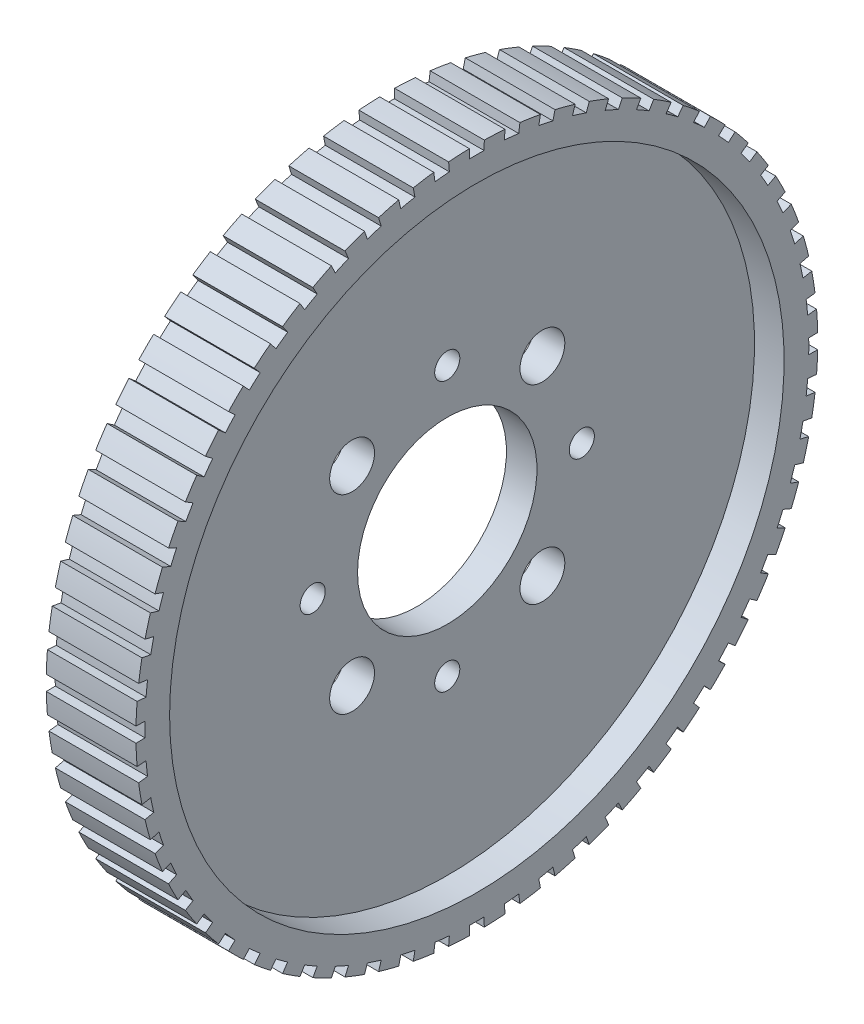
from build123d import *

# Parameters (mm, degrees)
SKETCH2_R          = 1.778
SKETCH2_R_2        = 3.175
CUT_EXTRUDE1_DEPTH = 69.778327117
CUT_EXTRUDE2_DEPTH = 70.421503873


with BuildPart() as part:
    # Sketch1 → Revolve1 (revolve)
    with BuildSketch(Plane.XY, mode=Mode.PRIVATE) as revolve1_sk:
        Polygon((-2.159, 12.7), (2.159, 12.7), (2.159, 43.4975), (6.35, 43.4975), (6.35, 48.26), (-6.35, 48.26), (-6.35, 43.4975), (-2.159, 43.4975), align=None)
    revolve(revolve1_sk.sketch.rotate(Axis((0, 0, 0), (1, 0, 0)), 90), axis=Axis((0, 0, 0), (1, 0, 0)))

    # Sketch2 → Cut-Extrude1 (cut, through all)
    with BuildSketch(Plane(origin=(2.159, 0, 0), x_dir=(0, 0, -1), z_dir=(1, 0, 0))):
        with Locations((0, 19.05)):
            Circle(SKETCH2_R)
        with Locations((19.05, 0)):
            Circle(SKETCH2_R)
        with Locations((0, -19.05)):
            Circle(SKETCH2_R)
        with Locations((-19.05, 0)):
            Circle(SKETCH2_R)
        with Locations((-13.470384182, 13.470384182)):
            Circle(SKETCH2_R_2)
        with Locations((13.470384182, 13.470384182)):
            Circle(SKETCH2_R_2)
        with Locations((13.470384182, -13.470384182)):
            Circle(SKETCH2_R_2)
        with Locations((-13.470384182, -13.470384182)):
            Circle(SKETCH2_R_2)
    extrude(amount=-CUT_EXTRUDE1_DEPTH, mode=Mode.SUBTRACT)

    # Sketch3 → Cut-Extrude2 (cut, through all)
    with BuildSketch(Plane(origin=(6.35, 0, 0), x_dir=(0, 0, -1), z_dir=(1, 0, 0))):
        with BuildLine():
            Line((-1.025081448, 46.978817652), (-1.080504445, 49.518817652))
            Line((-1.080504445, 49.518817652), (1.080504445, 49.518817652))
            Line((1.080504445, 49.518817652), (1.025081448, 46.978817652))
            ThreePointArc((1.025081448, 46.978817652), (0, 46.99), (-1.025081448, 46.978817652))
        make_face()
        with BuildLine():
            Line((4.101540584, 49.360491857), (6.250711241, 49.134604919))
            Line((6.250711241, 49.134604919), (5.93008956, 46.614312585))
            ThreePointArc((5.93008956, 46.614312585), (4.911792489, 46.732583863), (3.891157671, 46.828612962))
            Line((3.891157671, 46.828612962), (4.101540584, 49.360491857))
        make_face()
        with BuildLine():
            Line((9.238648275, 48.661362184), (11.352433936, 48.212063172))
            Line((11.352433936, 48.212063172), (10.770126369, 45.739091355))
            ThreePointArc((10.770126369, 45.739091355), (9.769770352, 45.963155758), (8.764764452, 46.165344189))
            Line((8.764764452, 46.165344189), (9.238648275, 48.661362184))
        make_face()
        with BuildLine():
            Line((14.274535403, 47.429088444), (16.329776989, 46.761299972))
            Line((16.329776989, 46.761299972), (15.492163421, 44.362743068))
            ThreePointArc((15.492163421, 44.362743068), (14.520708566, 44.690145701), (13.54234264, 44.996278244))
            Line((13.54234264, 44.996278244), (14.274535403, 47.429088444))
        make_face()
        with BuildLine():
            Line((19.154027733, 45.677171685), (21.128207589, 44.798210183))
            Line((21.128207589, 44.798210183), (20.044465088, 42.500347285))
            ThreePointArc((20.044465088, 42.500347285), (19.112554858, 42.927501055), (18.171548087, 43.334223659))
            Line((18.171548087, 43.334223659), (19.154027733, 45.677171685))
        make_face()
        with BuildLine():
            Line((23.823664528, 43.424806275), (25.695153124, 42.34430183))
            Line((25.695153124, 42.34430183), (24.377155401, 40.172308803))
            ThreePointArc((24.377155401, 40.172308803), (23.495, 40.694533724), (22.601662252, 41.197390251))
            Line((22.601662252, 41.197390251), (23.823664528, 43.424806275))
        make_face()
        with BuildLine():
            Line((28.232284269, 40.6966696), (29.980577186, 39.426460444))
            Line((29.980577186, 39.426460444), (28.442764498, 37.404134099))
            ThreePointArc((28.442764498, 37.404134099), (27.620029005, 38.015708566), (26.784147874, 38.609189614))
            Line((26.784147874, 38.609189614), (28.232284269, 40.6966696))
        make_face()
        with BuildLine():
            Line((32.331585195, 37.522651697), (33.937527769, 36.076654508))
            Line((33.937527769, 36.076654508), (32.196748715, 34.226151875))
            ThreePointArc((32.196748715, 34.226151875), (31.442447193, 34.920375349), (30.673180768, 35.597978616))
            Line((30.673180768, 35.597978616), (32.331585195, 37.522651697))
        make_face()
        with BuildLine():
            Line((36.076654508, 33.937527769), (37.522651697, 32.331585195))
            Line((37.522651697, 32.331585195), (35.597978616, 30.673180768))
            ThreePointArc((35.597978616, 30.673180768), (34.920375349, 31.442447193), (34.226151875, 32.196748715))
            Line((34.226151875, 32.196748715), (36.076654508, 33.937527769))
        make_face()
        with BuildLine():
            Line((39.426460444, 29.980577186), (40.6966696, 28.232284269))
            Line((40.6966696, 28.232284269), (38.609189614, 26.784147874))
            ThreePointArc((38.609189614, 26.784147874), (38.015708566, 27.620029005), (37.404134099, 28.442764498))
            Line((37.404134099, 28.442764498), (39.426460444, 29.980577186))
        make_face()
        with BuildLine():
            Line((42.34430183, 25.695153124), (43.424806275, 23.823664528))
            Line((43.424806275, 23.823664528), (41.197390251, 22.601662252))
            ThreePointArc((41.197390251, 22.601662252), (40.694533724, 23.495), (40.172308803, 24.377155401))
            Line((40.172308803, 24.377155401), (42.34430183, 25.695153124))
        make_face()
        with BuildLine():
            Line((44.798210183, 21.128207589), (45.677171685, 19.154027733))
            Line((45.677171685, 19.154027733), (43.334223659, 18.171548087))
            ThreePointArc((43.334223659, 18.171548087), (42.927501055, 19.112554858), (42.500347285, 20.044465088))
            Line((42.500347285, 20.044465088), (44.798210183, 21.128207589))
        make_face()
        with BuildLine():
            Line((46.761299972, 16.329776989), (47.429088444, 14.274535403))
            Line((47.429088444, 14.274535403), (44.996278244, 13.54234264))
            ThreePointArc((44.996278244, 13.54234264), (44.690145701, 14.520708566), (44.362743068, 15.492163421))
            Line((44.362743068, 15.492163421), (46.761299972, 16.329776989))
        make_face()
        with BuildLine():
            Line((48.212063172, 11.352433936), (48.661362184, 9.238648275))
            Line((48.661362184, 9.238648275), (46.165344189, 8.764764452))
            ThreePointArc((46.165344189, 8.764764452), (45.963155758, 9.769770352), (45.739091355, 10.770126369))
            Line((45.739091355, 10.770126369), (48.212063172, 11.352433936))
        make_face()
        with BuildLine():
            Line((49.134604919, 6.250711241), (49.360491857, 4.101540584))
            Line((49.360491857, 4.101540584), (46.828612962, 3.891157671))
            ThreePointArc((46.828612962, 3.891157671), (46.732583863, 4.911792489), (46.614312585, 5.93008956))
            Line((46.614312585, 5.93008956), (49.134604919, 6.250711241))
        make_face()
        with BuildLine():
            Line((49.518817652, 1.080504445), (49.518817652, -1.080504445))
            Line((49.518817652, -1.080504445), (46.978817652, -1.025081448))
            ThreePointArc((46.978817652, -1.025081448), (46.99, 0), (46.978817652, 1.025081448))
            Line((46.978817652, 1.025081448), (49.518817652, 1.080504445))
        make_face()
        with BuildLine():
            Line((49.360491857, -4.101540584), (49.134604919, -6.250711241))
            Line((49.134604919, -6.250711241), (46.614312585, -5.93008956))
            ThreePointArc((46.614312585, -5.93008956), (46.732583863, -4.911792489), (46.828612962, -3.891157671))
            Line((46.828612962, -3.891157671), (49.360491857, -4.101540584))
        make_face()
        with BuildLine():
            Line((48.661362184, -9.238648275), (48.212063172, -11.352433936))
            Line((48.212063172, -11.352433936), (45.739091355, -10.770126369))
            ThreePointArc((45.739091355, -10.770126369), (45.963155758, -9.769770352), (46.165344189, -8.764764452))
            Line((46.165344189, -8.764764452), (48.661362184, -9.238648275))
        make_face()
        with BuildLine():
            Line((47.429088444, -14.274535403), (46.761299972, -16.329776989))
            Line((46.761299972, -16.329776989), (44.362743068, -15.492163421))
            ThreePointArc((44.362743068, -15.492163421), (44.690145701, -14.520708566), (44.996278244, -13.54234264))
            Line((44.996278244, -13.54234264), (47.429088444, -14.274535403))
        make_face()
        with BuildLine():
            Line((45.677171685, -19.154027733), (44.798210183, -21.128207589))
            Line((44.798210183, -21.128207589), (42.500347285, -20.044465088))
            ThreePointArc((42.500347285, -20.044465088), (42.927501055, -19.112554858), (43.334223659, -18.171548087))
            Line((43.334223659, -18.171548087), (45.677171685, -19.154027733))
        make_face()
        with BuildLine():
            Line((43.424806275, -23.823664528), (42.34430183, -25.695153124))
            Line((42.34430183, -25.695153124), (40.172308803, -24.377155401))
            ThreePointArc((40.172308803, -24.377155401), (40.694533724, -23.495), (41.197390251, -22.601662252))
            Line((41.197390251, -22.601662252), (43.424806275, -23.823664528))
        make_face()
        with BuildLine():
            Line((40.6966696, -28.232284269), (39.426460444, -29.980577186))
            Line((39.426460444, -29.980577186), (37.404134099, -28.442764498))
            ThreePointArc((37.404134099, -28.442764498), (38.015708566, -27.620029005), (38.609189614, -26.784147874))
            Line((38.609189614, -26.784147874), (40.6966696, -28.232284269))
        make_face()
        with BuildLine():
            Line((37.522651697, -32.331585195), (36.076654508, -33.937527769))
            Line((36.076654508, -33.937527769), (34.226151875, -32.196748715))
            ThreePointArc((34.226151875, -32.196748715), (34.920375349, -31.442447193), (35.597978616, -30.673180768))
            Line((35.597978616, -30.673180768), (37.522651697, -32.331585195))
        make_face()
        with BuildLine():
            Line((33.937527769, -36.076654508), (32.331585195, -37.522651697))
            Line((32.331585195, -37.522651697), (30.673180768, -35.597978616))
            ThreePointArc((30.673180768, -35.597978616), (31.442447193, -34.920375349), (32.196748715, -34.226151875))
            Line((32.196748715, -34.226151875), (33.937527769, -36.076654508))
        make_face()
        with BuildLine():
            Line((29.980577186, -39.426460444), (28.232284269, -40.6966696))
            Line((28.232284269, -40.6966696), (26.784147874, -38.609189614))
            ThreePointArc((26.784147874, -38.609189614), (27.620029005, -38.015708566), (28.442764498, -37.404134099))
            Line((28.442764498, -37.404134099), (29.980577186, -39.426460444))
        make_face()
        with BuildLine():
            Line((25.695153124, -42.34430183), (23.823664528, -43.424806275))
            Line((23.823664528, -43.424806275), (22.601662252, -41.197390251))
            ThreePointArc((22.601662252, -41.197390251), (23.495, -40.694533724), (24.377155401, -40.172308803))
            Line((24.377155401, -40.172308803), (25.695153124, -42.34430183))
        make_face()
        with BuildLine():
            Line((21.128207589, -44.798210183), (19.154027733, -45.677171685))
            Line((19.154027733, -45.677171685), (18.171548087, -43.334223659))
            ThreePointArc((18.171548087, -43.334223659), (19.112554858, -42.927501055), (20.044465088, -42.500347285))
            Line((20.044465088, -42.500347285), (21.128207589, -44.798210183))
        make_face()
        with BuildLine():
            Line((16.329776989, -46.761299972), (14.274535403, -47.429088444))
            Line((14.274535403, -47.429088444), (13.54234264, -44.996278244))
            ThreePointArc((13.54234264, -44.996278244), (14.520708566, -44.690145701), (15.492163421, -44.362743068))
            Line((15.492163421, -44.362743068), (16.329776989, -46.761299972))
        make_face()
        with BuildLine():
            Line((11.352433936, -48.212063172), (9.238648275, -48.661362184))
            Line((9.238648275, -48.661362184), (8.764764452, -46.165344189))
            ThreePointArc((8.764764452, -46.165344189), (9.769770352, -45.963155758), (10.770126369, -45.739091355))
            Line((10.770126369, -45.739091355), (11.352433936, -48.212063172))
        make_face()
        with BuildLine():
            Line((6.250711241, -49.134604919), (4.101540584, -49.360491857))
            Line((4.101540584, -49.360491857), (3.891157671, -46.828612962))
            ThreePointArc((3.891157671, -46.828612962), (4.911792489, -46.732583863), (5.93008956, -46.614312585))
            Line((5.93008956, -46.614312585), (6.250711241, -49.134604919))
        make_face()
        with BuildLine():
            Line((1.080504445, -49.518817652), (-1.080504445, -49.518817652))
            Line((-1.080504445, -49.518817652), (-1.025081448, -46.978817652))
            ThreePointArc((-1.025081448, -46.978817652), (0, -46.99), (1.025081448, -46.978817652))
            Line((1.025081448, -46.978817652), (1.080504445, -49.518817652))
        make_face()
        with BuildLine():
            Line((-4.101540584, -49.360491857), (-6.250711241, -49.134604919))
            Line((-6.250711241, -49.134604919), (-5.93008956, -46.614312585))
            ThreePointArc((-5.93008956, -46.614312585), (-4.911792489, -46.732583863), (-3.891157671, -46.828612962))
            Line((-3.891157671, -46.828612962), (-4.101540584, -49.360491857))
        make_face()
        with BuildLine():
            Line((-9.238648275, -48.661362184), (-11.352433936, -48.212063172))
            Line((-11.352433936, -48.212063172), (-10.770126369, -45.739091355))
            ThreePointArc((-10.770126369, -45.739091355), (-9.769770352, -45.963155758), (-8.764764452, -46.165344189))
            Line((-8.764764452, -46.165344189), (-9.238648275, -48.661362184))
        make_face()
        with BuildLine():
            Line((-14.274535403, -47.429088444), (-16.329776989, -46.761299972))
            Line((-16.329776989, -46.761299972), (-15.492163421, -44.362743068))
            ThreePointArc((-15.492163421, -44.362743068), (-14.520708566, -44.690145701), (-13.54234264, -44.996278244))
            Line((-13.54234264, -44.996278244), (-14.274535403, -47.429088444))
        make_face()
        with BuildLine():
            Line((-19.154027733, -45.677171685), (-21.128207589, -44.798210183))
            Line((-21.128207589, -44.798210183), (-20.044465088, -42.500347285))
            ThreePointArc((-20.044465088, -42.500347285), (-19.112554858, -42.927501055), (-18.171548087, -43.334223659))
            Line((-18.171548087, -43.334223659), (-19.154027733, -45.677171685))
        make_face()
        with BuildLine():
            Line((-23.823664528, -43.424806275), (-25.695153124, -42.34430183))
            Line((-25.695153124, -42.34430183), (-24.377155401, -40.172308803))
            ThreePointArc((-24.377155401, -40.172308803), (-23.495, -40.694533724), (-22.601662252, -41.197390251))
            Line((-22.601662252, -41.197390251), (-23.823664528, -43.424806275))
        make_face()
        with BuildLine():
            Line((-28.232284269, -40.6966696), (-29.980577186, -39.426460444))
            Line((-29.980577186, -39.426460444), (-28.442764498, -37.404134099))
            ThreePointArc((-28.442764498, -37.404134099), (-27.620029005, -38.015708566), (-26.784147874, -38.609189614))
            Line((-26.784147874, -38.609189614), (-28.232284269, -40.6966696))
        make_face()
        with BuildLine():
            Line((-32.331585195, -37.522651697), (-33.937527769, -36.076654508))
            Line((-33.937527769, -36.076654508), (-32.196748715, -34.226151875))
            ThreePointArc((-32.196748715, -34.226151875), (-31.442447193, -34.920375349), (-30.673180768, -35.597978616))
            Line((-30.673180768, -35.597978616), (-32.331585195, -37.522651697))
        make_face()
        with BuildLine():
            Line((-36.076654508, -33.937527769), (-37.522651697, -32.331585195))
            Line((-37.522651697, -32.331585195), (-35.597978616, -30.673180768))
            ThreePointArc((-35.597978616, -30.673180768), (-34.920375349, -31.442447193), (-34.226151875, -32.196748715))
            Line((-34.226151875, -32.196748715), (-36.076654508, -33.937527769))
        make_face()
        with BuildLine():
            Line((-39.426460444, -29.980577186), (-40.6966696, -28.232284269))
            Line((-40.6966696, -28.232284269), (-38.609189614, -26.784147874))
            ThreePointArc((-38.609189614, -26.784147874), (-38.015708566, -27.620029005), (-37.404134099, -28.442764498))
            Line((-37.404134099, -28.442764498), (-39.426460444, -29.980577186))
        make_face()
        with BuildLine():
            Line((-42.34430183, -25.695153124), (-43.424806275, -23.823664528))
            Line((-43.424806275, -23.823664528), (-41.197390251, -22.601662252))
            ThreePointArc((-41.197390251, -22.601662252), (-40.694533724, -23.495), (-40.172308803, -24.377155401))
            Line((-40.172308803, -24.377155401), (-42.34430183, -25.695153124))
        make_face()
        with BuildLine():
            Line((-44.798210183, -21.128207589), (-45.677171685, -19.154027733))
            Line((-45.677171685, -19.154027733), (-43.334223659, -18.171548087))
            ThreePointArc((-43.334223659, -18.171548087), (-42.927501055, -19.112554858), (-42.500347285, -20.044465088))
            Line((-42.500347285, -20.044465088), (-44.798210183, -21.128207589))
        make_face()
        with BuildLine():
            Line((-46.761299972, -16.329776989), (-47.429088444, -14.274535403))
            Line((-47.429088444, -14.274535403), (-44.996278244, -13.54234264))
            ThreePointArc((-44.996278244, -13.54234264), (-44.690145701, -14.520708566), (-44.362743068, -15.492163421))
            Line((-44.362743068, -15.492163421), (-46.761299972, -16.329776989))
        make_face()
        with BuildLine():
            Line((-48.212063172, -11.352433936), (-48.661362184, -9.238648275))
            Line((-48.661362184, -9.238648275), (-46.165344189, -8.764764452))
            ThreePointArc((-46.165344189, -8.764764452), (-45.963155758, -9.769770352), (-45.739091355, -10.770126369))
            Line((-45.739091355, -10.770126369), (-48.212063172, -11.352433936))
        make_face()
        with BuildLine():
            Line((-49.134604919, -6.250711241), (-49.360491857, -4.101540584))
            Line((-49.360491857, -4.101540584), (-46.828612962, -3.891157671))
            ThreePointArc((-46.828612962, -3.891157671), (-46.732583863, -4.911792489), (-46.614312585, -5.93008956))
            Line((-46.614312585, -5.93008956), (-49.134604919, -6.250711241))
        make_face()
        with BuildLine():
            Line((-49.518817652, -1.080504445), (-49.518817652, 1.080504445))
            Line((-49.518817652, 1.080504445), (-46.978817652, 1.025081448))
            ThreePointArc((-46.978817652, 1.025081448), (-46.99, 0), (-46.978817652, -1.025081448))
            Line((-46.978817652, -1.025081448), (-49.518817652, -1.080504445))
        make_face()
        with BuildLine():
            Line((-49.360491857, 4.101540584), (-49.134604919, 6.250711241))
            Line((-49.134604919, 6.250711241), (-46.614312585, 5.93008956))
            ThreePointArc((-46.614312585, 5.93008956), (-46.732583863, 4.911792489), (-46.828612962, 3.891157671))
            Line((-46.828612962, 3.891157671), (-49.360491857, 4.101540584))
        make_face()
        with BuildLine():
            Line((-48.661362184, 9.238648275), (-48.212063172, 11.352433936))
            Line((-48.212063172, 11.352433936), (-45.739091355, 10.770126369))
            ThreePointArc((-45.739091355, 10.770126369), (-45.963155758, 9.769770352), (-46.165344189, 8.764764452))
            Line((-46.165344189, 8.764764452), (-48.661362184, 9.238648275))
        make_face()
        with BuildLine():
            Line((-47.429088444, 14.274535403), (-46.761299972, 16.329776989))
            Line((-46.761299972, 16.329776989), (-44.362743068, 15.492163421))
            ThreePointArc((-44.362743068, 15.492163421), (-44.690145701, 14.520708566), (-44.996278244, 13.54234264))
            Line((-44.996278244, 13.54234264), (-47.429088444, 14.274535403))
        make_face()
        with BuildLine():
            Line((-45.677171685, 19.154027733), (-44.798210183, 21.128207589))
            Line((-44.798210183, 21.128207589), (-42.500347285, 20.044465088))
            ThreePointArc((-42.500347285, 20.044465088), (-42.927501055, 19.112554858), (-43.334223659, 18.171548087))
            Line((-43.334223659, 18.171548087), (-45.677171685, 19.154027733))
        make_face()
        with BuildLine():
            Line((-43.424806275, 23.823664528), (-42.34430183, 25.695153124))
            Line((-42.34430183, 25.695153124), (-40.172308803, 24.377155401))
            ThreePointArc((-40.172308803, 24.377155401), (-40.694533724, 23.495), (-41.197390251, 22.601662252))
            Line((-41.197390251, 22.601662252), (-43.424806275, 23.823664528))
        make_face()
        with BuildLine():
            Line((-40.6966696, 28.232284269), (-39.426460444, 29.980577186))
            Line((-39.426460444, 29.980577186), (-37.404134099, 28.442764498))
            ThreePointArc((-37.404134099, 28.442764498), (-38.015708566, 27.620029005), (-38.609189614, 26.784147874))
            Line((-38.609189614, 26.784147874), (-40.6966696, 28.232284269))
        make_face()
        with BuildLine():
            Line((-37.522651697, 32.331585195), (-36.076654508, 33.937527769))
            Line((-36.076654508, 33.937527769), (-34.226151875, 32.196748715))
            ThreePointArc((-34.226151875, 32.196748715), (-34.920375349, 31.442447193), (-35.597978616, 30.673180768))
            Line((-35.597978616, 30.673180768), (-37.522651697, 32.331585195))
        make_face()
        with BuildLine():
            Line((-33.937527769, 36.076654508), (-32.331585195, 37.522651697))
            Line((-32.331585195, 37.522651697), (-30.673180768, 35.597978616))
            ThreePointArc((-30.673180768, 35.597978616), (-31.442447193, 34.920375349), (-32.196748715, 34.226151875))
            Line((-32.196748715, 34.226151875), (-33.937527769, 36.076654508))
        make_face()
        with BuildLine():
            Line((-29.980577186, 39.426460444), (-28.232284269, 40.6966696))
            Line((-28.232284269, 40.6966696), (-26.784147874, 38.609189614))
            ThreePointArc((-26.784147874, 38.609189614), (-27.620029005, 38.015708566), (-28.442764498, 37.404134099))
            Line((-28.442764498, 37.404134099), (-29.980577186, 39.426460444))
        make_face()
        with BuildLine():
            Line((-25.695153124, 42.34430183), (-23.823664528, 43.424806275))
            Line((-23.823664528, 43.424806275), (-22.601662252, 41.197390251))
            ThreePointArc((-22.601662252, 41.197390251), (-23.495, 40.694533724), (-24.377155401, 40.172308803))
            Line((-24.377155401, 40.172308803), (-25.695153124, 42.34430183))
        make_face()
        with BuildLine():
            Line((-21.128207589, 44.798210183), (-19.154027733, 45.677171685))
            Line((-19.154027733, 45.677171685), (-18.171548087, 43.334223659))
            ThreePointArc((-18.171548087, 43.334223659), (-19.112554858, 42.927501055), (-20.044465088, 42.500347285))
            Line((-20.044465088, 42.500347285), (-21.128207589, 44.798210183))
        make_face()
        with BuildLine():
            Line((-16.329776989, 46.761299972), (-14.274535403, 47.429088444))
            Line((-14.274535403, 47.429088444), (-13.54234264, 44.996278244))
            ThreePointArc((-13.54234264, 44.996278244), (-14.520708566, 44.690145701), (-15.492163421, 44.362743068))
            Line((-15.492163421, 44.362743068), (-16.329776989, 46.761299972))
        make_face()
        with BuildLine():
            Line((-11.352433936, 48.212063172), (-9.238648275, 48.661362184))
            Line((-9.238648275, 48.661362184), (-8.764764452, 46.165344189))
            ThreePointArc((-8.764764452, 46.165344189), (-9.769770352, 45.963155758), (-10.770126369, 45.739091355))
            Line((-10.770126369, 45.739091355), (-11.352433936, 48.212063172))
        make_face()
        with BuildLine():
            Line((-6.250711241, 49.134604919), (-4.101540584, 49.360491857))
            Line((-4.101540584, 49.360491857), (-3.891157671, 46.828612962))
            ThreePointArc((-3.891157671, 46.828612962), (-4.911792489, 46.732583863), (-5.93008956, 46.614312585))
            Line((-5.93008956, 46.614312585), (-6.250711241, 49.134604919))
        make_face()
    extrude(amount=-CUT_EXTRUDE2_DEPTH, mode=Mode.SUBTRACT)


solid = part.part
